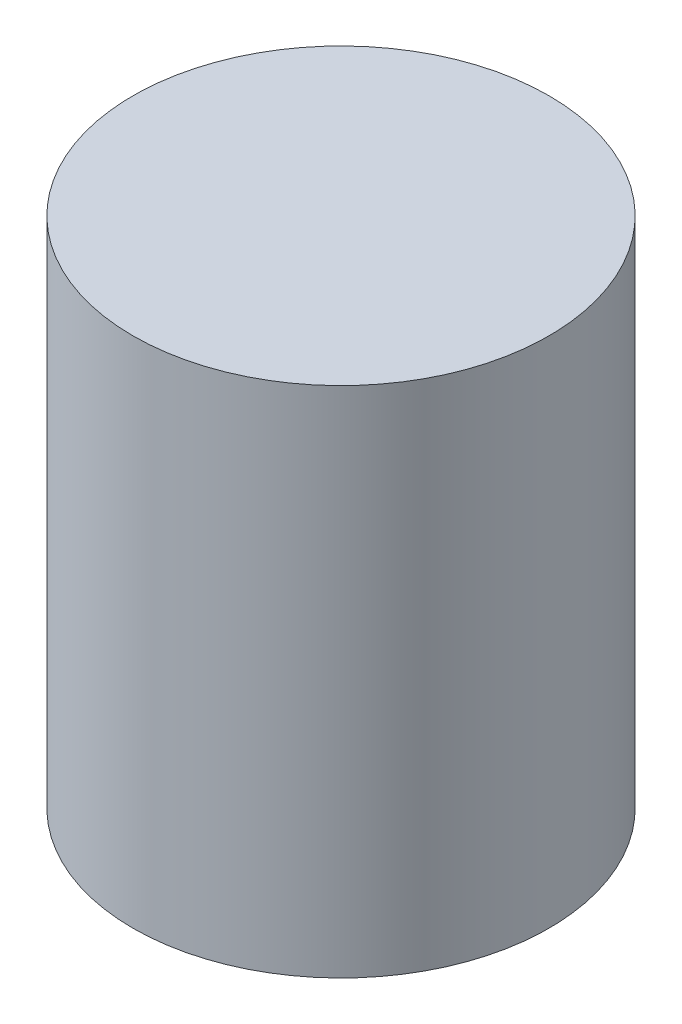
from build123d import *

# Parameters (mm, degrees)
IZIM1_R                     = 7.5
Y_KSEKLIK_EKSTR_ZYON1_DEPTH = 18.5


with BuildPart() as part:
    # Çizim1 → Yükseklik-Ekstrüzyon1 (new body)
    with BuildSketch(Plane(origin=(0, 0, 0), x_dir=(1, 0, 0), z_dir=(0, 1, 0))):
        with Locations(Location((0, 0, 0), (0, 0, 270))):
            Circle(IZIM1_R)
    extrude(amount=Y_KSEKLIK_EKSTR_ZYON1_DEPTH)


solid = part.part
